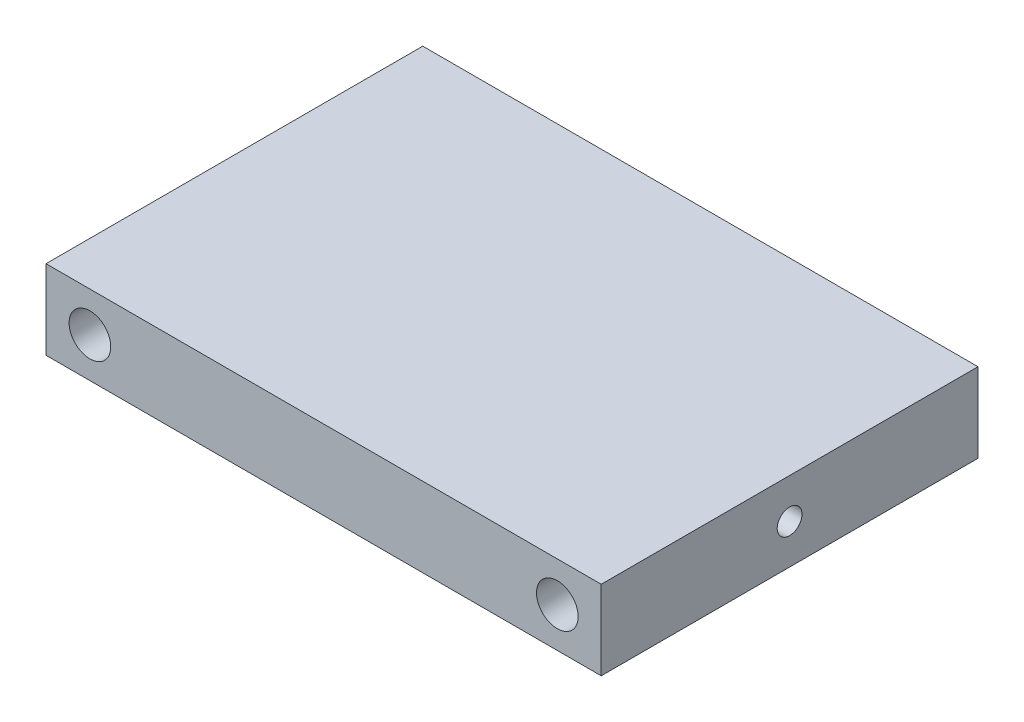
from build123d import *

# Parameters (mm, degrees)
SKETCH_1_W          = 56
SKETCH_1_H          = 8
EXTRUDE_1_DEPTH     = 38
SKETCH_2_R          = 2.1
CUT_EXTRUDE_1_DEPTH = 69.14690015
SKETCH_3_R          = 1.25
CUT_EXTRUDE_2_DEPTH = 20


with BuildPart() as part:
    # Эскиз1 → Бобышка-Вытянуть1 (new body)
    with BuildSketch(Plane.XY):
        with Locations((28, 4)):
            Rectangle(SKETCH_1_W, SKETCH_1_H)
    extrude(amount=EXTRUDE_1_DEPTH)

    # Эскиз2 → Вырез-Вытянуть1 (cut, through all)
    with BuildSketch(Plane.XY.offset(38)):
        with Locations((4.43, 4)):
            Circle(SKETCH_2_R)
        with Locations((51.57, 4)):
            Circle(SKETCH_2_R)
    extrude(amount=-CUT_EXTRUDE_1_DEPTH, mode=Mode.SUBTRACT)

    # Эскиз3 → Вырез-Вытянуть2 (cut)
    with BuildSketch(Plane(origin=(56, 0, 0), x_dir=(0, 0, -1), z_dir=(1, 0, 0))):
        with Locations((-19, 4)):
            Circle(SKETCH_3_R)
    extrude(amount=-CUT_EXTRUDE_2_DEPTH, mode=Mode.SUBTRACT)


solid = part.part
